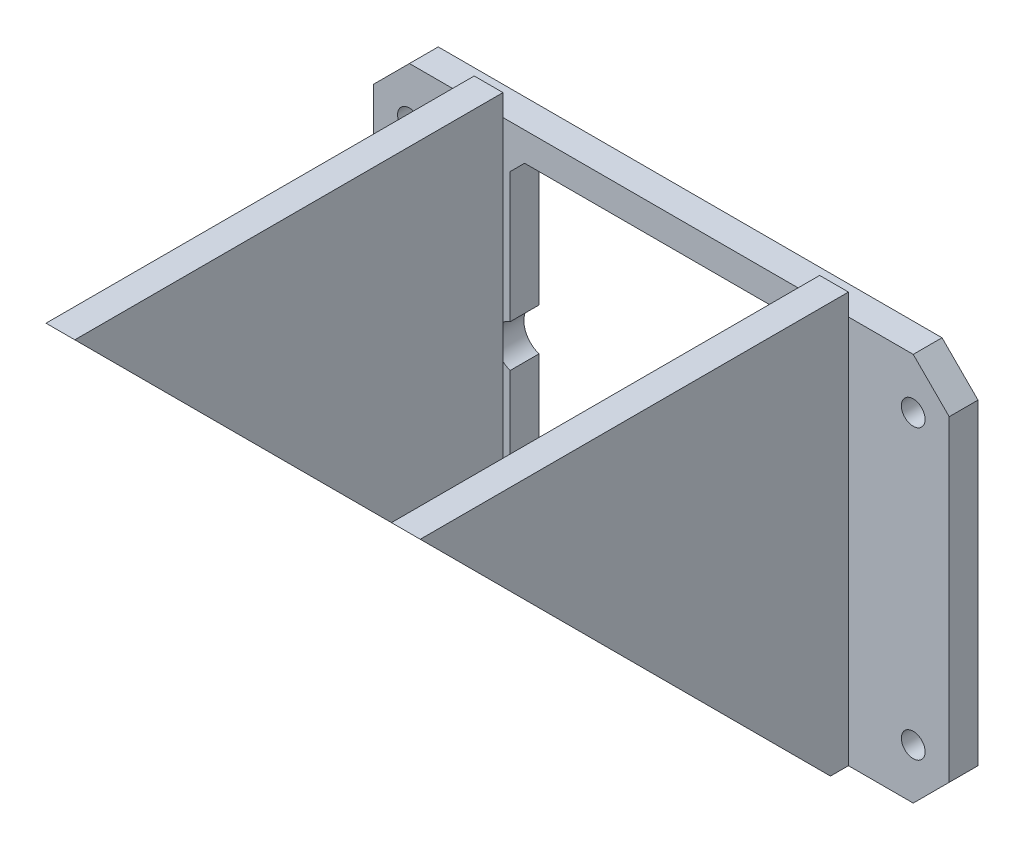
from build123d import *

# Parameters (mm, degrees)
F_4MM_START                  = 7
SKETCH_1_R                   = 1.65
F_4MM_DEPTH                  = 4
EXTRUDE_START                = -26
EXTRUDE_45_1_DEPTH           = 4
EXTRUDE_START_2              = 22
EXTRUDE_45_1_2_DEPTH         = 4
CUT_EXTRUDE_48X36_DEPTH      = 14
CUT_EXTRUDE_48X36_DEPTH_BACK = 14
SKETCH_4_R                   = 1.65
CUT_EXTRUDE_START            = 7
SKETCH_5_R                   = 3.1
CUT_EXTRUDE_631_DEPTH        = 4


with BuildPart() as part:
    # 草图1 → 雷达座底法兰_4mm (new body)
    with BuildSketch(Plane.XY.offset(F_4MM_START)):
        Polygon((-35, -112), (35, -112), (40, -107), (40, -63), (35, -58), (-35, -58), (-40, -63), (-40, -107), align=None)
        with Locations((-35, -105)):
            Circle(SKETCH_1_R, mode=Mode.SUBTRACT)
        with Locations((-35, -65)):
            Circle(SKETCH_1_R, mode=Mode.SUBTRACT)
        with Locations((35, -105)):
            Circle(SKETCH_1_R, mode=Mode.SUBTRACT)
        with Locations((35, -65)):
            Circle(SKETCH_1_R, mode=Mode.SUBTRACT)
        Polygon((-19, -108), (19, -108), (21, -106), (21, -64), (19, -62), (-19, -62), (-21, -64), (-21, -106), align=None, mode=Mode.SUBTRACT)
    extrude(amount=F_4MM_DEPTH)

    # 草图2 → Extrude 45__-1 (add)
    with BuildSketch(Plane(origin=(0, 0, 0), x_dir=(0, 0, -1), z_dir=(1, 0, 0)).offset(EXTRUDE_START)):
        Polygon((-11, -112), (-11, -55), (-70.5, -55), (-13.5, -112), align=None)
    extrude(amount=EXTRUDE_45_1_DEPTH)

    # 草图3 → Extrude 45__1 2 (add)
    with BuildSketch(Plane(origin=(0, 0, 0), x_dir=(0, 0, -1), z_dir=(1, 0, 0)).offset(EXTRUDE_START_2)):
        Polygon((-11, -112), (-11, -55), (-70.5, -55), (-13.5, -112), align=None)
    extrude(amount=EXTRUDE_45_1_2_DEPTH)

    # 草图4 → 雷达托板48x36四孔_双向贯穿 (cut, two sides: drawn at the far end of the back side and taken through both)
    with BuildSketch(Plane(origin=(0, -62.75, 62.75), x_dir=(1, 0, 0), z_dir=(0, -0.7071067811865475, 0.7071067811865476)).offset(-CUT_EXTRUDE_48X36_DEPTH_BACK)):
        with Locations(Location((-24, -49.539844892, 0), (0, 0, 270))):
            Circle(SKETCH_4_R)
        with Locations(Location((-24, -13.539844892, 0), (0, 0, 270))):
            Circle(SKETCH_4_R)
        with Locations(Location((24, -49.539844892, 0), (0, 0, 270))):
            Circle(SKETCH_4_R)
        with Locations(Location((24, -13.539844892, 0), (0, 0, 270))):
            Circle(SKETCH_4_R)
    extrude(amount=CUT_EXTRUDE_48X36_DEPTH + CUT_EXTRUDE_48X36_DEPTH_BACK, mode=Mode.SUBTRACT)

    # 草图5 → Cut-Extrude 631 (cut)
    with BuildSketch(Plane.XY.offset(CUT_EXTRUDE_START)):
        with Locations((-20, -85)):
            Circle(SKETCH_5_R)
        with Locations((20, -85)):
            Circle(SKETCH_5_R)
    extrude(amount=CUT_EXTRUDE_631_DEPTH, mode=Mode.SUBTRACT)


solid = part.part
